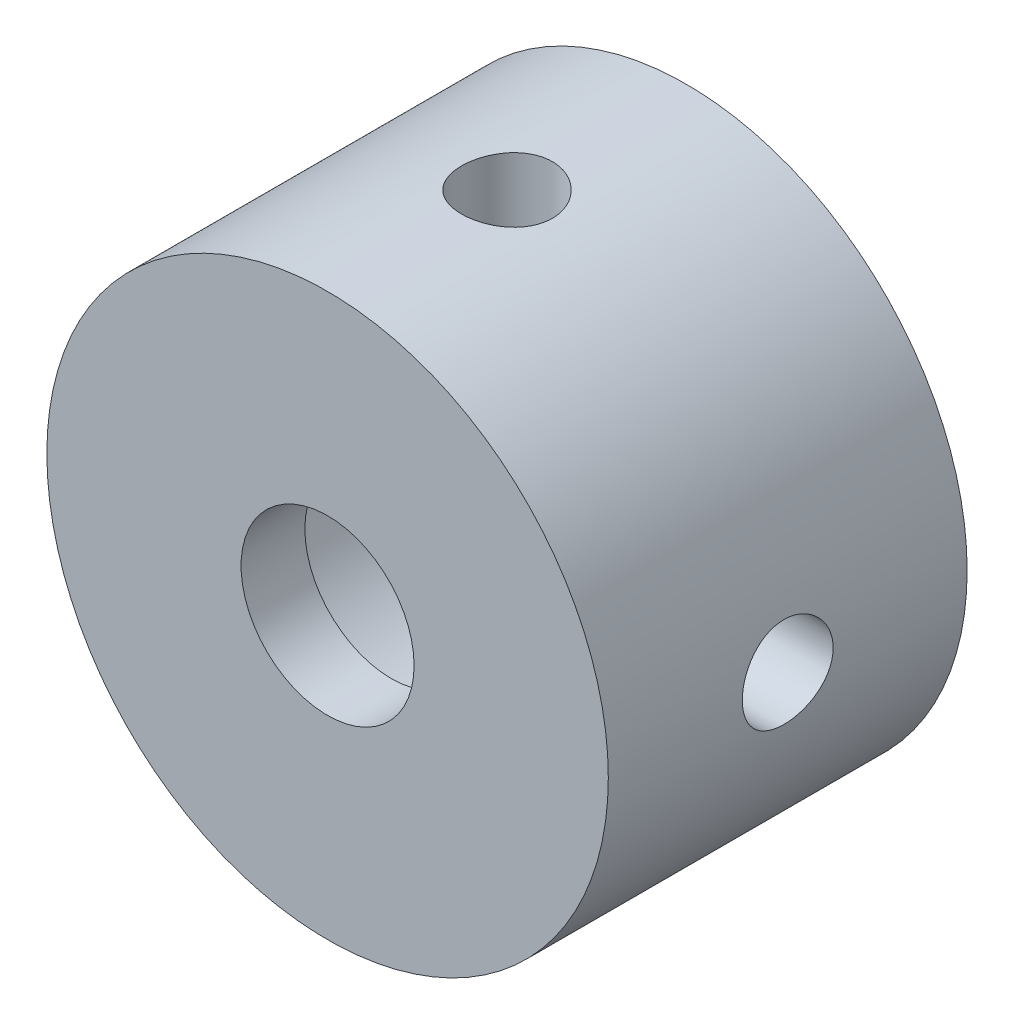
from build123d import *

# Parameters (mm, degrees)
F_8_CLEARANCE_HOLE1_D      = 4.3053
F_4_40_TAPPED_HOLE1_REACH  = 24.433
F_4_40_TAPPED_HOLE1_BORE_R = 1.1303
CIRPATTERN1_COUNT          = 4


with BuildPart() as part:
    # Sketch1 → Revolve1 (revolve)
    with BuildSketch(Plane(origin=(0, 0, 0), x_dir=(0, 0, -1), z_dir=(1, 0, 0)), mode=Mode.PRIVATE) as revolve1_sk:
        Polygon((-14.515600128, 3.81), (-7.175000128, 3.81), (-7.175000128, 4.500000017), (-7.175000128, 6.985), (-16.103100128, 6.985), (-16.103100128, 0), (-14.515600128, 0), (-14.515600128, 3.429), align=None)
    revolve(revolve1_sk.sketch.rotate(Axis((0, 0, 9.953125128), (0, 0, -1)), 90), axis=Axis((0, 0, 9.953125128), (0, 0, -1)))

    # #8 Clearance Hole1 (through all)
    with Locations(Plane.XY.offset(16.103100128)):
        with Locations((0, 0)):
            Hole(F_8_CLEARANCE_HOLE1_D / 2)

    # #4-40 Tapped Hole1 bore → #4-40 Tapped Hole1 (cut, up to next)
    with BuildSketch(Plane(origin=(0, 6.985, 0), x_dir=(1, 0, 0), z_dir=(0, 1, 0)), mode=Mode.PRIVATE) as f_4_40_tapped_hole1_sk1:
        with Locations((0, -11.639050128)):
            Circle(F_4_40_TAPPED_HOLE1_BORE_R)
    f_4_40_tapped_hole1_tool1 = extrude(f_4_40_tapped_hole1_sk1.sketch, amount=-F_4_40_TAPPED_HOLE1_REACH, mode=Mode.PRIVATE) & part.part
    f_4_40_tapped_hole1 = f_4_40_tapped_hole1_tool1.solids().sort_by_distance((0, 6.985, 11.63905))[0]
    add(f_4_40_tapped_hole1, mode=Mode.SUBTRACT)

    # CirPattern1: #4-40 Tapped Hole1 ×4 about axis
    cirpattern1_axis = Axis((0, 0, 9.953125128), (0, 0, 1))
    for i in range(1, CIRPATTERN1_COUNT):
        add(f_4_40_tapped_hole1.rotate(cirpattern1_axis, i * 360 / CIRPATTERN1_COUNT), mode=Mode.SUBTRACT)


solid = part.part
